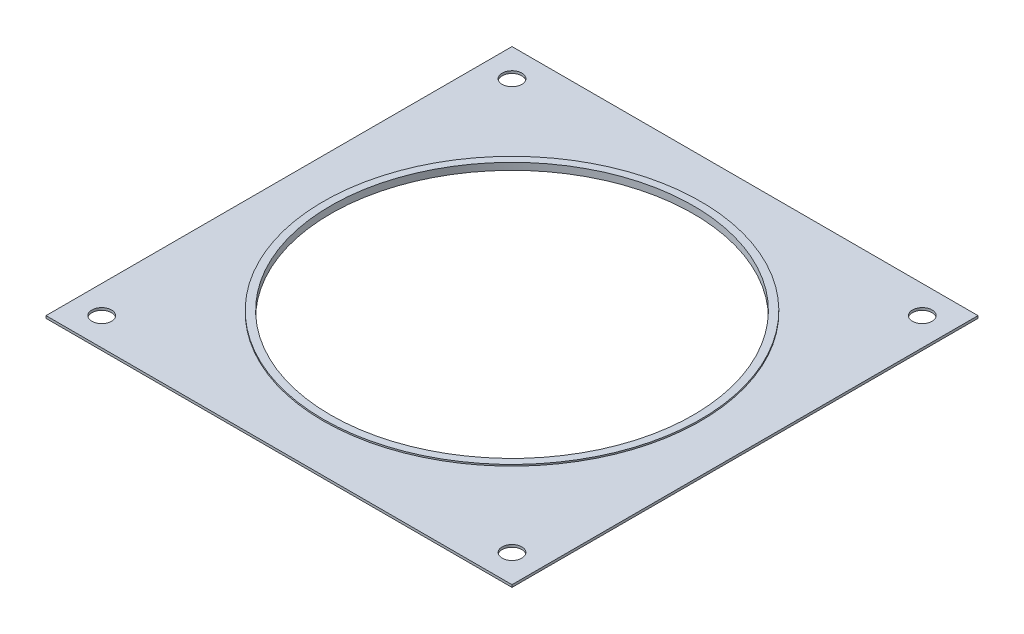
from build123d import *

# Parameters (mm, degrees)
CROQUIS1_W              = 154.2
CROQUIS1_H              = 154.2
SALIENTE_EXTRUIR1_DEPTH = 0.8
CROQUIS2_R              = 60
CORTAR_EXTRUIR1_DEPTH   = 110.038800434
SALIENTE_EXTRUIR2_START = 1
CROQUIS3_R              = 60.995810587
CROQUIS3_R_2            = 60
SALIENTE_EXTRUIR2_DEPTH = 1
SALIENTE_EXTRUIR3_START = 0.5
CROQUIS4_R              = 62.434019261
CROQUIS4_R_2            = 60
SALIENTE_EXTRUIR3_DEPTH = 0.5
CROQUIS5_R              = 3.25
CORTAR_EXTRUIR2_DEPTH   = 110.046182877


with BuildPart() as part:
    # Croquis1 → Saliente-Extruir1 (new body)
    with BuildSketch(Plane(origin=(0, 0, 0), x_dir=(1, 0, 0), z_dir=(0, 1, 0))):
        Rectangle(CROQUIS1_W, CROQUIS1_H)
    extrude(amount=SALIENTE_EXTRUIR1_DEPTH)

    # Croquis2 → Cortar-Extruir1 (cut, through all)
    with BuildSketch(Plane(origin=(0, 0.8, 0), x_dir=(1, 0, 0), z_dir=(0, 1, 0))):
        with Locations(Location((0, 0, 0), (0, 0, 270))):
            Circle(CROQUIS2_R)
    extrude(amount=-CORTAR_EXTRUIR1_DEPTH, mode=Mode.SUBTRACT)

    # Croquis3 → Saliente-Extruir2 (add)
    with BuildSketch(Plane(origin=(0, 0.8, 0), x_dir=(1, 0, 0), z_dir=(0, 1, 0)).offset(SALIENTE_EXTRUIR2_START)):
        with Locations(Location((0, 0, 0), (0, 0, 90))):
            Circle(CROQUIS3_R)
        with Locations(Location((0, 0, 0), (0, 0, 270))):
            Circle(CROQUIS3_R_2, mode=Mode.SUBTRACT)
    extrude(amount=-SALIENTE_EXTRUIR2_DEPTH)

    # Croquis4 → Saliente-Extruir3 (add)
    with BuildSketch(Plane(origin=(0, 1.8, 0), x_dir=(1, 0, 0), z_dir=(0, 1, 0)).offset(SALIENTE_EXTRUIR3_START)):
        with Locations(Location((0, 0, 0), (0, 0, 270))):
            Circle(CROQUIS4_R)
        with Locations(Location((0, 0, 0), (0, 0, 270))):
            Circle(CROQUIS4_R_2, mode=Mode.SUBTRACT)
    extrude(amount=-SALIENTE_EXTRUIR3_DEPTH)

    # Croquis5 → Cortar-Extruir2 (cut, through all)
    with BuildSketch(Plane(origin=(0, 0.8, 0), x_dir=(1, 0, 0), z_dir=(0, 1, 0))):
        with Locations(Location((-67.882250994, 67.882250994, 0), (0, 0, 270))):
            Circle(CROQUIS5_R)
        with Locations(Location((67.882250994, 67.882250994, 0), (0, 0, 90))):
            Circle(CROQUIS5_R)
        with Locations(Location((-67.882250994, -67.882250994, 0), (0, 0, 90))):
            Circle(CROQUIS5_R)
        with Locations(Location((67.882250994, -67.882250994, 0), (0, 0, 270))):
            Circle(CROQUIS5_R)
    extrude(amount=-CORTAR_EXTRUIR2_DEPTH, mode=Mode.SUBTRACT)


solid = part.part
